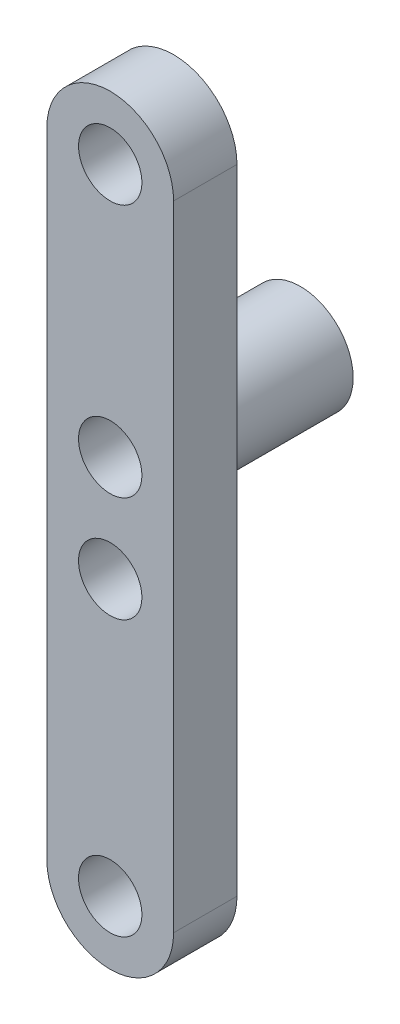
from build123d import *

# Parameters (mm, degrees)
SKETCH_1_R      = 1.5
EXTRUDE_1_DEPTH = 3
SKETCH_3_R      = 2.5
SKETCH_3_R_2    = 1.5
EXTRUDE_2_DEPTH = 6


with BuildPart() as part:
    # ｽｹｯﾁ1 → ﾎﾞｽ - 押し出し1 (new body)
    with BuildSketch(Plane.XY):
        with BuildLine():
            Line((-3, 0), (-3, -30))
            ThreePointArc((-3, -30), (0, -33), (3, -30))
            Line((3, -30), (3, 0))
            ThreePointArc((3, 0), (0, 3), (-3, 0))
        make_face()
        Circle(SKETCH_1_R, mode=Mode.SUBTRACT)
        with Locations(Location((0, -30, 0), (0, 0, 180))):
            Circle(SKETCH_1_R, mode=Mode.SUBTRACT)
        with Locations((0, -17)):
            Circle(SKETCH_1_R, mode=Mode.SUBTRACT)
        with Locations((0, -12)):
            Circle(SKETCH_1_R, mode=Mode.SUBTRACT)
    extrude(amount=EXTRUDE_1_DEPTH)


with BuildPart() as body_2:
    # ｽｹｯﾁ3 → ﾎﾞｽ - 押し出し2 (new body)
    with BuildSketch(Plane.XY):
        with Locations((0, -12)):
            Circle(SKETCH_3_R)
        with Locations((0, -12)):
            Circle(SKETCH_3_R_2, mode=Mode.SUBTRACT)
    extrude(amount=-EXTRUDE_2_DEPTH)


solid = Compound([part.part, body_2.part])
